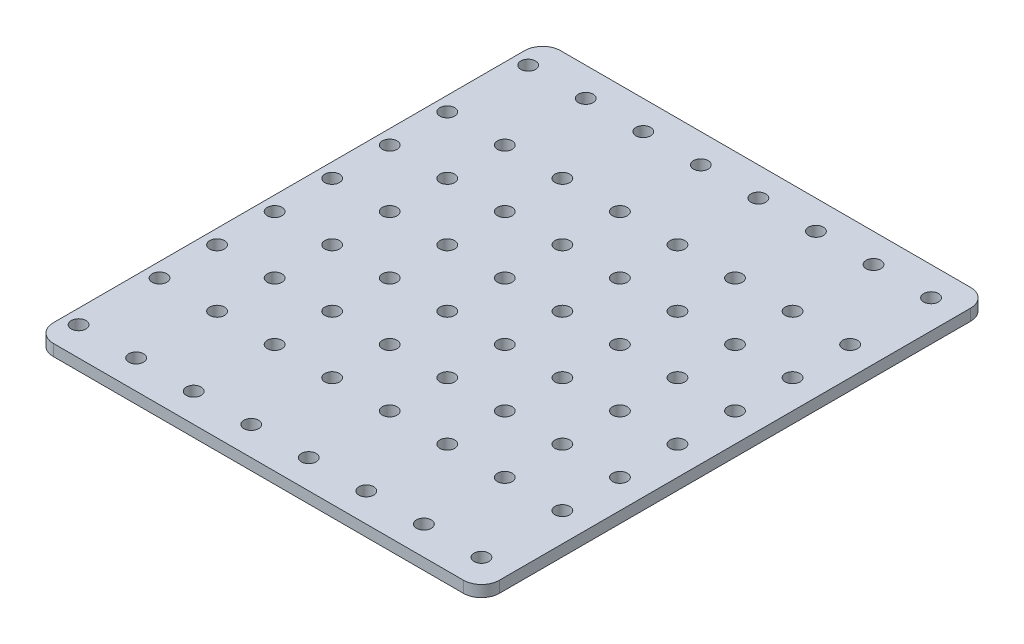
from build123d import *

# Parameters (mm, degrees)
SKETCH1_W           = 124
SKETCH1_H           = 141
SKETCH1_R           = 2.05
BOSS_EXTRUDE1_DEPTH = 3.175
FILLET1_R           = 5


with BuildPart() as part:
    # Sketch1 → Boss-Extrude1 (new body)
    with BuildSketch(Plane(origin=(0, 0, 0), x_dir=(1, 0, 0), z_dir=(0, 1, 0))):
        Rectangle(SKETCH1_W, SKETCH1_H)
        with Locations(Location((-58, -62.5, 0), (0, 0, 270))):
            Circle(SKETCH1_R, mode=Mode.SUBTRACT)
        with Locations(Location((-42, -62.5, 0), (0, 0, 270))):
            Circle(SKETCH1_R, mode=Mode.SUBTRACT)
        with Locations(Location((-26, -62.5, 0), (0, 0, 270))):
            Circle(SKETCH1_R, mode=Mode.SUBTRACT)
        with Locations(Location((-10, -62.5, 0), (0, 0, 270))):
            Circle(SKETCH1_R, mode=Mode.SUBTRACT)
        with Locations(Location((6, -62.5, 0), (0, 0, 270))):
            Circle(SKETCH1_R, mode=Mode.SUBTRACT)
        with Locations(Location((22, -62.5, 0), (0, 0, 270))):
            Circle(SKETCH1_R, mode=Mode.SUBTRACT)
        with Locations(Location((38, -62.5, 0), (0, 0, 270))):
            Circle(SKETCH1_R, mode=Mode.SUBTRACT)
        with Locations(Location((54, -62.5, 0), (0, 0, 270))):
            Circle(SKETCH1_R, mode=Mode.SUBTRACT)
        with Locations(Location((38, -40, 0), (0, 0, 270))):
            Circle(SKETCH1_R, mode=Mode.SUBTRACT)
        with Locations(Location((22, -40, 0), (0, 0, 270))):
            Circle(SKETCH1_R, mode=Mode.SUBTRACT)
        with Locations(Location((6, -40, 0), (0, 0, 270))):
            Circle(SKETCH1_R, mode=Mode.SUBTRACT)
        with Locations(Location((-10, -40, 0), (0, 0, 270))):
            Circle(SKETCH1_R, mode=Mode.SUBTRACT)
        with Locations(Location((-26, -40, 0), (0, 0, 270))):
            Circle(SKETCH1_R, mode=Mode.SUBTRACT)
        with Locations(Location((-42, -40, 0), (0, 0, 270))):
            Circle(SKETCH1_R, mode=Mode.SUBTRACT)
        with Locations(Location((-58, -40, 0), (0, 0, 270))):
            Circle(SKETCH1_R, mode=Mode.SUBTRACT)
        with Locations(Location((38, -24, 0), (0, 0, 270))):
            Circle(SKETCH1_R, mode=Mode.SUBTRACT)
        with Locations(Location((22, -24, 0), (0, 0, 270))):
            Circle(SKETCH1_R, mode=Mode.SUBTRACT)
        with Locations(Location((6, -24, 0), (0, 0, 270))):
            Circle(SKETCH1_R, mode=Mode.SUBTRACT)
        with Locations(Location((-10, -24, 0), (0, 0, 270))):
            Circle(SKETCH1_R, mode=Mode.SUBTRACT)
        with Locations(Location((-26, -24, 0), (0, 0, 270))):
            Circle(SKETCH1_R, mode=Mode.SUBTRACT)
        with Locations(Location((-42, -24, 0), (0, 0, 270))):
            Circle(SKETCH1_R, mode=Mode.SUBTRACT)
        with Locations(Location((-58, -24, 0), (0, 0, 270))):
            Circle(SKETCH1_R, mode=Mode.SUBTRACT)
        with Locations(Location((38, -8, 0), (0, 0, 270))):
            Circle(SKETCH1_R, mode=Mode.SUBTRACT)
        with Locations(Location((22, -8, 0), (0, 0, 270))):
            Circle(SKETCH1_R, mode=Mode.SUBTRACT)
        with Locations(Location((6, -8, 0), (0, 0, 270))):
            Circle(SKETCH1_R, mode=Mode.SUBTRACT)
        with Locations(Location((-10, -8, 0), (0, 0, 270))):
            Circle(SKETCH1_R, mode=Mode.SUBTRACT)
        with Locations(Location((-26, -8, 0), (0, 0, 270))):
            Circle(SKETCH1_R, mode=Mode.SUBTRACT)
        with Locations(Location((-42, -8, 0), (0, 0, 270))):
            Circle(SKETCH1_R, mode=Mode.SUBTRACT)
        with Locations(Location((-58, -8, 0), (0, 0, 270))):
            Circle(SKETCH1_R, mode=Mode.SUBTRACT)
        with Locations(Location((38, 8, 0), (0, 0, 270))):
            Circle(SKETCH1_R, mode=Mode.SUBTRACT)
        with Locations(Location((22, 8, 0), (0, 0, 270))):
            Circle(SKETCH1_R, mode=Mode.SUBTRACT)
        with Locations(Location((6, 8, 0), (0, 0, 270))):
            Circle(SKETCH1_R, mode=Mode.SUBTRACT)
        with Locations(Location((-10, 8, 0), (0, 0, 270))):
            Circle(SKETCH1_R, mode=Mode.SUBTRACT)
        with Locations(Location((-26, 8, 0), (0, 0, 270))):
            Circle(SKETCH1_R, mode=Mode.SUBTRACT)
        with Locations(Location((-42, 8, 0), (0, 0, 270))):
            Circle(SKETCH1_R, mode=Mode.SUBTRACT)
        with Locations(Location((-58, 8, 0), (0, 0, 270))):
            Circle(SKETCH1_R, mode=Mode.SUBTRACT)
        with Locations(Location((38, 24, 0), (0, 0, 270))):
            Circle(SKETCH1_R, mode=Mode.SUBTRACT)
        with Locations(Location((22, 24, 0), (0, 0, 270))):
            Circle(SKETCH1_R, mode=Mode.SUBTRACT)
        with Locations(Location((6, 24, 0), (0, 0, 270))):
            Circle(SKETCH1_R, mode=Mode.SUBTRACT)
        with Locations(Location((-10, 24, 0), (0, 0, 270))):
            Circle(SKETCH1_R, mode=Mode.SUBTRACT)
        with Locations(Location((-26, 24, 0), (0, 0, 270))):
            Circle(SKETCH1_R, mode=Mode.SUBTRACT)
        with Locations(Location((-42, 24, 0), (0, 0, 270))):
            Circle(SKETCH1_R, mode=Mode.SUBTRACT)
        with Locations(Location((-58, 24, 0), (0, 0, 270))):
            Circle(SKETCH1_R, mode=Mode.SUBTRACT)
        with Locations(Location((38, 40, 0), (0, 0, 270))):
            Circle(SKETCH1_R, mode=Mode.SUBTRACT)
        with Locations(Location((22, 40, 0), (0, 0, 270))):
            Circle(SKETCH1_R, mode=Mode.SUBTRACT)
        with Locations(Location((6, 40, 0), (0, 0, 270))):
            Circle(SKETCH1_R, mode=Mode.SUBTRACT)
        with Locations(Location((-10, 40, 0), (0, 0, 270))):
            Circle(SKETCH1_R, mode=Mode.SUBTRACT)
        with Locations(Location((-26, 40, 0), (0, 0, 270))):
            Circle(SKETCH1_R, mode=Mode.SUBTRACT)
        with Locations(Location((-42, 40, 0), (0, 0, 270))):
            Circle(SKETCH1_R, mode=Mode.SUBTRACT)
        with Locations(Location((-58, 40, 0), (0, 0, 270))):
            Circle(SKETCH1_R, mode=Mode.SUBTRACT)
        with Locations(Location((54, -40, 0), (0, 0, 270))):
            Circle(SKETCH1_R, mode=Mode.SUBTRACT)
        with Locations(Location((54, -24, 0), (0, 0, 270))):
            Circle(SKETCH1_R, mode=Mode.SUBTRACT)
        with Locations(Location((54, -8, 0), (0, 0, 270))):
            Circle(SKETCH1_R, mode=Mode.SUBTRACT)
        with Locations(Location((54, 8, 0), (0, 0, 270))):
            Circle(SKETCH1_R, mode=Mode.SUBTRACT)
        with Locations(Location((54, 24, 0), (0, 0, 270))):
            Circle(SKETCH1_R, mode=Mode.SUBTRACT)
        with Locations(Location((54, 40, 0), (0, 0, 270))):
            Circle(SKETCH1_R, mode=Mode.SUBTRACT)
        with Locations(Location((-58, 62.5, 0), (0, 0, 90))):
            Circle(SKETCH1_R, mode=Mode.SUBTRACT)
        with Locations(Location((-42, 62.5, 0), (0, 0, 90))):
            Circle(SKETCH1_R, mode=Mode.SUBTRACT)
        with Locations(Location((-26, 62.5, 0), (0, 0, 90))):
            Circle(SKETCH1_R, mode=Mode.SUBTRACT)
        with Locations(Location((-10, 62.5, 0), (0, 0, 90))):
            Circle(SKETCH1_R, mode=Mode.SUBTRACT)
        with Locations(Location((6, 62.5, 0), (0, 0, 90))):
            Circle(SKETCH1_R, mode=Mode.SUBTRACT)
        with Locations(Location((22, 62.5, 0), (0, 0, 90))):
            Circle(SKETCH1_R, mode=Mode.SUBTRACT)
        with Locations(Location((38, 62.5, 0), (0, 0, 90))):
            Circle(SKETCH1_R, mode=Mode.SUBTRACT)
        with Locations(Location((54, 62.5, 0), (0, 0, 90))):
            Circle(SKETCH1_R, mode=Mode.SUBTRACT)
    extrude(amount=BOSS_EXTRUDE1_DEPTH)

    # Fillet1
    fillet1_edges = [part.edges().sort_by_distance(p)[0] for p in [
        (-62, 1.5875, -70.5),
        (62, 1.5875, -70.5),
        (62, 1.5875, 70.5),
        (-62, 1.5875, 70.5),
    ]]
    fillet(fillet1_edges, radius=FILLET1_R)


solid = part.part
